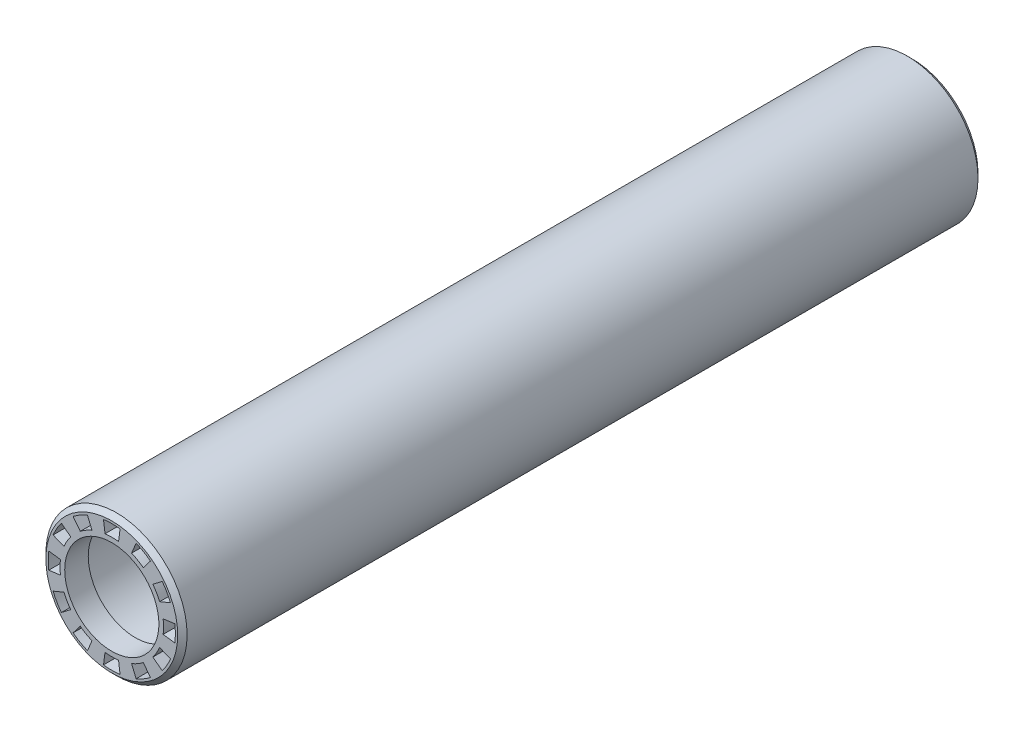
from build123d import *

# Parameters (mm, degrees)
SKETCH1_R             = 15
SKETCH1_R_2           = 12
BOSS_EXTRUDE1_DEPTH   = 85
CHAMFER1_SIZE         = 1
SKETCH2_R             = 12
SKETCH2_R_2           = 10
BOSS_EXTRUDE2_DEPTH   = 5
CUT_EXTRUDE1_DEPTH    = 3
CIRPATTERN1_COUNT     = 12
MIRROR2_COPY_1_DEPTH  = 3
MIRROR2_COPY_2_DEPTH  = 3
MIRROR2_COPY_3_DEPTH  = 3
MIRROR2_COPY_4_DEPTH  = 3
MIRROR2_COPY_5_DEPTH  = 3
MIRROR2_COPY_6_DEPTH  = 3
MIRROR2_COPY_7_DEPTH  = 3
MIRROR2_COPY_8_DEPTH  = 3
MIRROR2_COPY_9_DEPTH  = 3
MIRROR2_COPY_10_DEPTH = 3
MIRROR2_COPY_11_DEPTH = 3


with BuildPart() as part:
    # Sketch1 → Boss-Extrude1 (new, symmetric)
    with BuildSketch(Plane.XY):
        Circle(SKETCH1_R)
        Circle(SKETCH1_R_2, mode=Mode.SUBTRACT)
    extrude(amount=BOSS_EXTRUDE1_DEPTH, both=True)

    # Chamfer1
    chamfer1_edges = [part.edges().sort_by_distance(p)[0] for p in [
        (-15, 0, -85),
        (-15, 0, 85),
    ]]
    chamfer(chamfer1_edges, length=CHAMFER1_SIZE)

    # Sketch2 → Boss-Extrude2 (add)
    with BuildSketch(Plane(origin=(0, 0, -85), x_dir=(-1, 0, 0), z_dir=(0, 0, -1))):
        Circle(SKETCH2_R)
        Circle(SKETCH2_R_2, mode=Mode.SUBTRACT)
    boss_extrude2 = extrude(amount=-BOSS_EXTRUDE2_DEPTH)

    # Mirror1: Boss-Extrude2 across plane
    add(boss_extrude2.mirror(Plane.XY))

    # Sketch3 → Cut-Extrude1 (cut)
    with BuildSketch(Plane(origin=(0, 0, -85), x_dir=(-1, 0, 0), z_dir=(0, 0, -1))):
        with BuildLine():
            Line((-1.435788114, 10.905893475), (-1.762103595, 13.384505629))
            ThreePointArc((-1.762103595, 13.384505629), (0, 13.5), (1.762103595, 13.384505629))
            Line((1.762103595, 13.384505629), (1.435788114, 10.905893475))
            ThreePointArc((1.435788114, 10.905893475), (0, 11), (-1.435788114, 10.905893475))
        make_face()
    cut_extrude1 = extrude(amount=-CUT_EXTRUDE1_DEPTH, mode=Mode.SUBTRACT)

    # CirPattern1: Cut-Extrude1 ×12 about axis
    cirpattern1_axis = Axis((0, 0, 0), (0, 0, 1))
    for i in range(1, CIRPATTERN1_COUNT):
        add(cut_extrude1.rotate(cirpattern1_axis, i * 360 / CIRPATTERN1_COUNT), mode=Mode.SUBTRACT)

    # Mirror2: Cut-Extrude1 across plane
    add(cut_extrude1.mirror(Plane.XY), mode=Mode.SUBTRACT)

    # Mirror2 copy 1 sketch → Mirror2 copy 1 (cut)
    with BuildSketch(Plane(origin=(0, 0, 85), x_dir=(-0.8660254037844387, -0.49999999999999994, 0), z_dir=(0, 0, 1))):
        with BuildLine():
            Line((-1.435788114, -10.905893475), (-1.762103595, -13.384505629))
            ThreePointArc((-1.762103595, -13.384505629), (0, -13.5), (1.762103595, -13.384505629))
            Line((1.762103595, -13.384505629), (1.435788114, -10.905893475))
            ThreePointArc((1.435788114, -10.905893475), (0, -11), (-1.435788114, -10.905893475))
        make_face()
    extrude(amount=-MIRROR2_COPY_1_DEPTH, mode=Mode.SUBTRACT)

    # Mirror2 copy 2 sketch → Mirror2 copy 2 (cut)
    with BuildSketch(Plane(origin=(0, 0, 85), x_dir=(-0.5000000000000001, -0.8660254037844386, 0), z_dir=(0, 0, 1))):
        with BuildLine():
            Line((-1.435788114, -10.905893475), (-1.762103595, -13.384505629))
            ThreePointArc((-1.762103595, -13.384505629), (0, -13.5), (1.762103595, -13.384505629))
            Line((1.762103595, -13.384505629), (1.435788114, -10.905893475))
            ThreePointArc((1.435788114, -10.905893475), (0, -11), (-1.435788114, -10.905893475))
        make_face()
    extrude(amount=-MIRROR2_COPY_2_DEPTH, mode=Mode.SUBTRACT)

    # Mirror2 copy 3 sketch → Mirror2 copy 3 (cut)
    with BuildSketch(Plane(origin=(0, 0, 85), x_dir=(0, -1, 0), z_dir=(0, 0, 1))):
        with BuildLine():
            Line((-1.435788114, -10.905893475), (-1.762103595, -13.384505629))
            ThreePointArc((-1.762103595, -13.384505629), (0, -13.5), (1.762103595, -13.384505629))
            Line((1.762103595, -13.384505629), (1.435788114, -10.905893475))
            ThreePointArc((1.435788114, -10.905893475), (0, -11), (-1.435788114, -10.905893475))
        make_face()
    extrude(amount=-MIRROR2_COPY_3_DEPTH, mode=Mode.SUBTRACT)

    # Mirror2 copy 4 sketch → Mirror2 copy 4 (cut)
    with BuildSketch(Plane(origin=(0, 0, 85), x_dir=(0.4999999999999998, -0.8660254037844387, 0), z_dir=(0, 0, 1))):
        with BuildLine():
            Line((-1.435788114, -10.905893475), (-1.762103595, -13.384505629))
            ThreePointArc((-1.762103595, -13.384505629), (0, -13.5), (1.762103595, -13.384505629))
            Line((1.762103595, -13.384505629), (1.435788114, -10.905893475))
            ThreePointArc((1.435788114, -10.905893475), (0, -11), (-1.435788114, -10.905893475))
        make_face()
    extrude(amount=-MIRROR2_COPY_4_DEPTH, mode=Mode.SUBTRACT)

    # Mirror2 copy 5 sketch → Mirror2 copy 5 (cut)
    with BuildSketch(Plane(origin=(0, 0, 85), x_dir=(0.8660254037844387, -0.49999999999999994, 0), z_dir=(0, 0, 1))):
        with BuildLine():
            Line((-1.435788114, -10.905893475), (-1.762103595, -13.384505629))
            ThreePointArc((-1.762103595, -13.384505629), (0, -13.5), (1.762103595, -13.384505629))
            Line((1.762103595, -13.384505629), (1.435788114, -10.905893475))
            ThreePointArc((1.435788114, -10.905893475), (0, -11), (-1.435788114, -10.905893475))
        make_face()
    extrude(amount=-MIRROR2_COPY_5_DEPTH, mode=Mode.SUBTRACT)

    # Mirror2 copy 6 sketch → Mirror2 copy 6 (cut)
    with BuildSketch(Plane.XY.offset(85)):
        with BuildLine():
            Line((-1.435788114, -10.905893475), (-1.762103595, -13.384505629))
            ThreePointArc((-1.762103595, -13.384505629), (0, -13.5), (1.762103595, -13.384505629))
            Line((1.762103595, -13.384505629), (1.435788114, -10.905893475))
            ThreePointArc((1.435788114, -10.905893475), (0, -11), (-1.435788114, -10.905893475))
        make_face()
    extrude(amount=-MIRROR2_COPY_6_DEPTH, mode=Mode.SUBTRACT)

    # Mirror2 copy 7 sketch → Mirror2 copy 7 (cut)
    with BuildSketch(Plane(origin=(0, 0, 85), x_dir=(0.8660254037844386, 0.5000000000000001, 0), z_dir=(0, 0, 1))):
        with BuildLine():
            Line((-1.435788114, -10.905893475), (-1.762103595, -13.384505629))
            ThreePointArc((-1.762103595, -13.384505629), (0, -13.5), (1.762103595, -13.384505629))
            Line((1.762103595, -13.384505629), (1.435788114, -10.905893475))
            ThreePointArc((1.435788114, -10.905893475), (0, -11), (-1.435788114, -10.905893475))
        make_face()
    extrude(amount=-MIRROR2_COPY_7_DEPTH, mode=Mode.SUBTRACT)

    # Mirror2 copy 8 sketch → Mirror2 copy 8 (cut)
    with BuildSketch(Plane(origin=(0, 0, 85), x_dir=(0.5000000000000004, 0.8660254037844384, 0), z_dir=(0, 0, 1))):
        with BuildLine():
            Line((-1.435788114, -10.905893475), (-1.762103595, -13.384505629))
            ThreePointArc((-1.762103595, -13.384505629), (0, -13.5), (1.762103595, -13.384505629))
            Line((1.762103595, -13.384505629), (1.435788114, -10.905893475))
            ThreePointArc((1.435788114, -10.905893475), (0, -11), (-1.435788114, -10.905893475))
        make_face()
    extrude(amount=-MIRROR2_COPY_8_DEPTH, mode=Mode.SUBTRACT)

    # Mirror2 copy 9 sketch → Mirror2 copy 9 (cut)
    with BuildSketch(Plane(origin=(0, 0, 85), x_dir=(0, 1, 0), z_dir=(0, 0, 1))):
        with BuildLine():
            Line((-1.435788114, -10.905893475), (-1.762103595, -13.384505629))
            ThreePointArc((-1.762103595, -13.384505629), (0, -13.5), (1.762103595, -13.384505629))
            Line((1.762103595, -13.384505629), (1.435788114, -10.905893475))
            ThreePointArc((1.435788114, -10.905893475), (0, -11), (-1.435788114, -10.905893475))
        make_face()
    extrude(amount=-MIRROR2_COPY_9_DEPTH, mode=Mode.SUBTRACT)

    # Mirror2 copy 10 sketch → Mirror2 copy 10 (cut)
    with BuildSketch(Plane(origin=(0, 0, 85), x_dir=(-0.5000000000000001, 0.8660254037844386, 0), z_dir=(0, 0, 1))):
        with BuildLine():
            Line((-1.435788114, -10.905893475), (-1.762103595, -13.384505629))
            ThreePointArc((-1.762103595, -13.384505629), (0, -13.5), (1.762103595, -13.384505629))
            Line((1.762103595, -13.384505629), (1.435788114, -10.905893475))
            ThreePointArc((1.435788114, -10.905893475), (0, -11), (-1.435788114, -10.905893475))
        make_face()
    extrude(amount=-MIRROR2_COPY_10_DEPTH, mode=Mode.SUBTRACT)

    # Mirror2 copy 11 sketch → Mirror2 copy 11 (cut)
    with BuildSketch(Plane(origin=(0, 0, 85), x_dir=(-0.8660254037844384, 0.5000000000000004, 0), z_dir=(0, 0, 1))):
        with BuildLine():
            Line((-1.435788114, -10.905893475), (-1.762103595, -13.384505629))
            ThreePointArc((-1.762103595, -13.384505629), (0, -13.5), (1.762103595, -13.384505629))
            Line((1.762103595, -13.384505629), (1.435788114, -10.905893475))
            ThreePointArc((1.435788114, -10.905893475), (0, -11), (-1.435788114, -10.905893475))
        make_face()
    extrude(amount=-MIRROR2_COPY_11_DEPTH, mode=Mode.SUBTRACT)


solid = part.part
